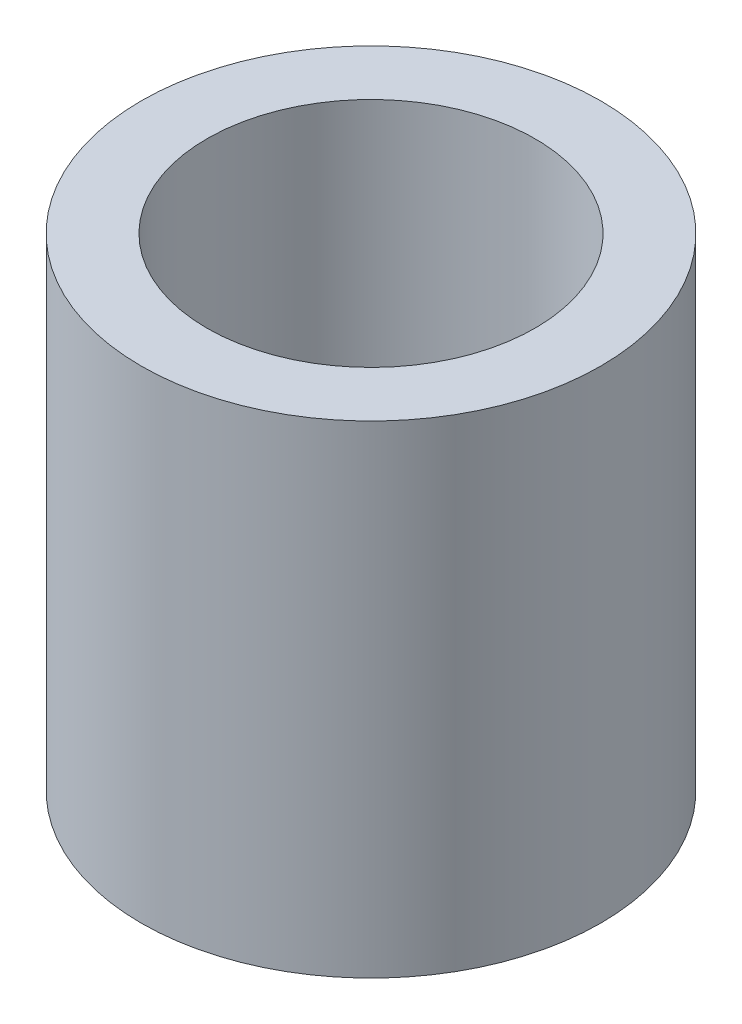
from build123d import *

# Parameters (mm, degrees)
SKETCH1_R           = 3.5
SKETCH1_R_2         = 2.5
BOSS_EXTRUDE1_DEPTH = 7.35


with BuildPart() as part:
    # Sketch1 → Boss-Extrude1 (new body)
    with BuildSketch(Plane(origin=(0, 0, 0), x_dir=(1, 0, 0), z_dir=(0, 1, 0))):
        with Locations(Location((0, 0, 0), (0, 0, 270))):
            Circle(SKETCH1_R)
        with Locations(Location((0, 0, 0), (0, 0, 270))):
            Circle(SKETCH1_R_2, mode=Mode.SUBTRACT)
    extrude(amount=BOSS_EXTRUDE1_DEPTH)


solid = part.part
